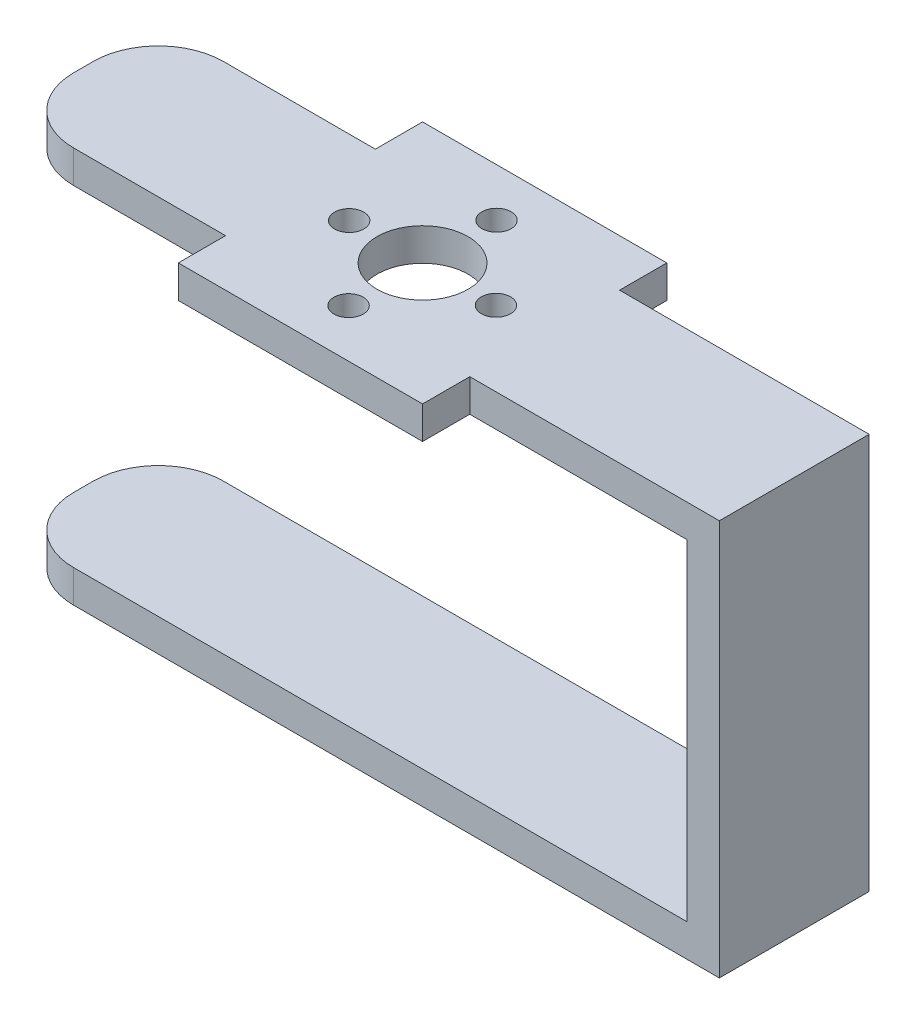
from build123d import *

# Parameters (mm, degrees)
SKETCH1_R           = 2.25
SKETCH1_R_2         = 7
BOSS_EXTRUDE2_DEPTH = 5
SKETCH1_3_W         = 5
SKETCH1_3_H         = 23
BOSS_EXTRUDE3_DEPTH = 60.8
SKETCH3_W           = 109.14
SKETCH3_H           = 23
BOSS_EXTRUDE4_DEPTH = 5
SKETCH4_R           = 3
BOSS_EXTRUDE5_DEPTH = 5
FILLET3_R           = 10


with BuildPart() as part:
    # Sketch1 → Boss-Extrude2 (new body)
    with BuildSketch(Plane(origin=(0, 0, 0), x_dir=(1, 0, 0), z_dir=(0, 1, 0))):
        Polygon((52.07, 11.5), (18.75, 11.5), (18.75, 18.75), (-18.75, 18.75), (-18.75, 11.5), (-52.07, 11.5), (-52.07, -11.5), (-18.75, -11.5), (-18.75, -18.75), (18.75, -18.75), (18.75, -11.5), (52.07, -11.5), align=None)
        with Locations((0, 11.358)):
            Circle(SKETCH1_R, mode=Mode.SUBTRACT)
        with Locations((11.26924292, 0)):
            Circle(SKETCH1_R, mode=Mode.SUBTRACT)
        with Locations((-11.26924292, 0)):
            Circle(SKETCH1_R, mode=Mode.SUBTRACT)
        with Locations((0, -11.358)):
            Circle(SKETCH1_R, mode=Mode.SUBTRACT)
        Circle(SKETCH1_R_2, mode=Mode.SUBTRACT)
    extrude(amount=-BOSS_EXTRUDE2_DEPTH)

    # Sketch1<3> → Boss-Extrude3 (add)
    with BuildSketch(Plane(origin=(0, 0, 0), x_dir=(1, 0, 0), z_dir=(0, 1, 0))):
        with Locations((54.57, 0)):
            Rectangle(SKETCH1_3_W, SKETCH1_3_H)
    extrude(amount=-BOSS_EXTRUDE3_DEPTH)

    # Sketch3 → Boss-Extrude4 (add)
    with BuildSketch(Plane.XZ.offset(60.8)):
        with Locations((2.5, 0)):
            Rectangle(SKETCH3_W, SKETCH3_H)
    extrude(amount=-BOSS_EXTRUDE4_DEPTH)

    # Sketch4 → Boss-Extrude5 (add)
    with BuildSketch(Plane.XZ.offset(60.8)):
        Circle(SKETCH4_R)
    extrude(amount=BOSS_EXTRUDE5_DEPTH)

    # Fillet3
    fillet3_edges = [part.edges().sort_by_distance(p)[0] for p in [
        (-52.07, -58.3, -11.5),
        (-52.07, -58.3, 11.5),
        (-52.07, -2.5, -11.5),
        (-52.07, -2.5, 11.5),
    ]]
    fillet(fillet3_edges, radius=FILLET3_R)


solid = part.part
